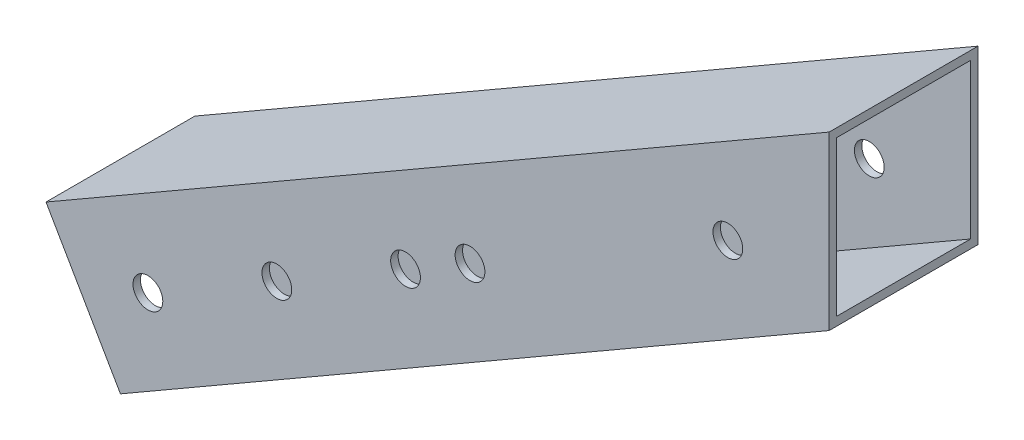
from build123d import *

# Parameters (mm, degrees)
SKETCH_1_R          = 2
EXTRUDE_1_DEPTH     = 20
SKETCH_2_W          = 18
SKETCH_2_H          = 18
CUT_EXTRUDE_1_DEPTH = 124.162075769


with BuildPart() as part:
    # 草图1 → 凸台-拉伸1 (new body)
    with BuildSketch(Plane.XY):
        Polygon((-47.722320689, -23.749341584), (-37.722320689, -41.06984966), (57.484792643, 13.898002851), (57.484792643, 36.992013619), align=None)
        with Locations((43.880219689, 17.590404378)):
            Circle(SKETCH_1_R, mode=Mode.SUBTRACT)
        with Locations((9.239203538, -2.409595622)):
            Circle(SKETCH_1_R, mode=Mode.SUBTRACT)
        with Locations((0.5789495, -7.409595622)):
            Circle(SKETCH_1_R, mode=Mode.SUBTRACT)
        with Locations((-16.712437168, -17.458303329)):
            Circle(SKETCH_1_R, mode=Mode.SUBTRACT)
        with Locations((-34.032945243, -27.458303329)):
            Circle(SKETCH_1_R, mode=Mode.SUBTRACT)
    extrude(amount=EXTRUDE_1_DEPTH)

    # 草图2 → 切除-拉伸1 (cut, through all)
    with BuildSketch(Plane(origin=(-46.075507084, -26.601706418, 0), x_dir=(0, 0, 1), z_dir=(-0.8660254037844416, -0.49999999999999517, 0))):
        with Locations((10, -6.70637279)):
            Rectangle(SKETCH_2_W, SKETCH_2_H)
    extrude(amount=-CUT_EXTRUDE_1_DEPTH, mode=Mode.SUBTRACT)


solid = part.part
